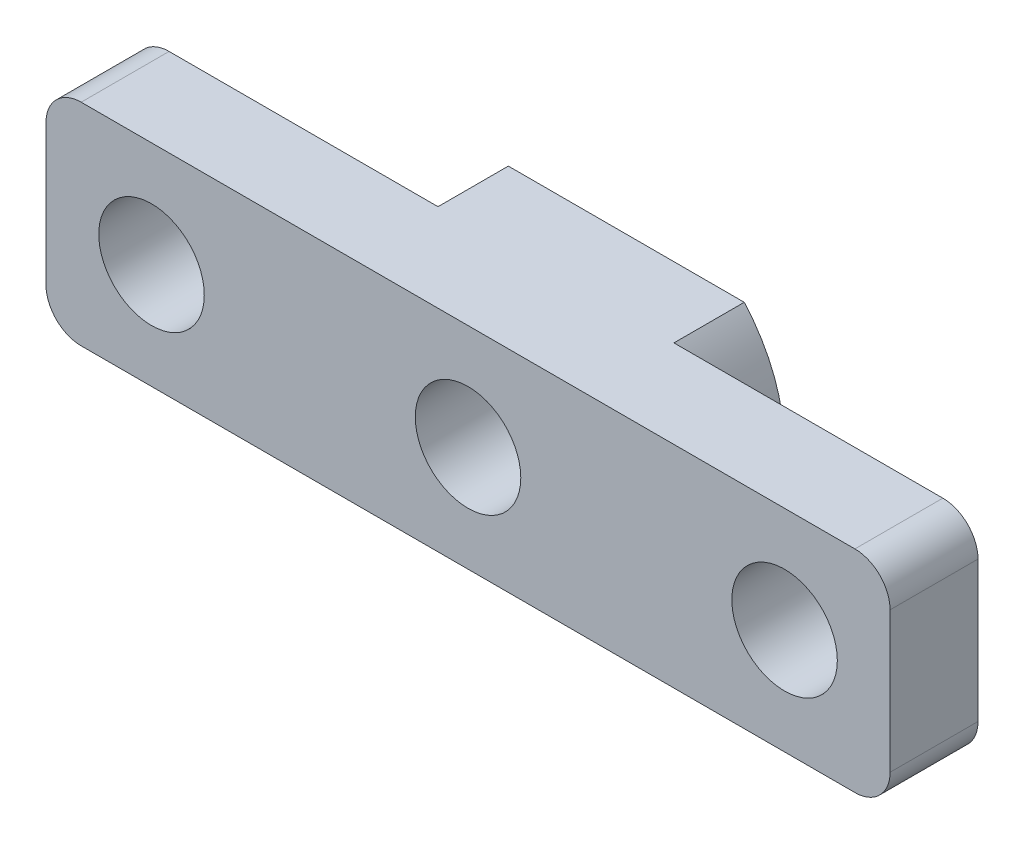
from build123d import *
from build123d.topology import SkipClean

# Parameters (mm, degrees)
SKETCH1_W           = 24
SKETCH1_H           = 6
SKETCH1_R           = 1.5
BOSS_EXTRUDE2_DEPTH = 2.5
FILLET1_R           = 1
FILLET2_R           = 1
BOSS_EXTRUDE3_START = 2
SKETCH2_R           = 1.5
BOSS_EXTRUDE3_DEPTH = 2


with BuildPart() as part:
    # Sketch1 → Boss-Extrude2 (new body)
    with BuildSketch(Plane.XY):
        with Locations((9, 0)):
            Rectangle(SKETCH1_W, SKETCH1_H)
        Circle(SKETCH1_R, mode=Mode.SUBTRACT)
        with Locations((9, 0)):
            Circle(SKETCH1_R, mode=Mode.SUBTRACT)
        with Locations((18, 0)):
            Circle(SKETCH1_R, mode=Mode.SUBTRACT)
    extrude(amount=BOSS_EXTRUDE2_DEPTH)

    # Fillet1
    fillet1_edges = [part.edges().sort_by_distance(p)[0] for p in [
        (-3, 3, 1.25),
    ]]
    fillet(fillet1_edges, radius=FILLET1_R)

    # Fillet2
    fillet2_edges = [part.edges().sort_by_distance(p)[0] for p in [
        (21, 3, 1.25),
        (21, -3, 1.25),
        (-3, -3, 1.25),
    ]]
    fillet(fillet2_edges, radius=FILLET2_R)

    # Sketch2 → Boss-Extrude3 (add)
    with SkipClean():  # the faces are left unmerged after this step: merging them gives an invalid solid
        with BuildSketch(Plane(origin=(0, 0, 0), x_dir=(-1, 0, 0), z_dir=(0, 0, -1)).offset(BOSS_EXTRUDE3_START)):
            with BuildLine():
                Line((-5.645898034, -3), (-12.354101966, -3))
                ThreePointArc((-12.354101966, -3), (-13.5, 0), (-12.354101966, 3))
                Line((-12.354101966, 3), (-5.645898034, 3))
                ThreePointArc((-5.645898034, 3), (-4.5, 0), (-5.645898034, -3))
            make_face()
            with Locations((-9, 0)):
                Circle(SKETCH2_R, mode=Mode.SUBTRACT)
        extrude(amount=-BOSS_EXTRUDE3_DEPTH)


solid = part.part
